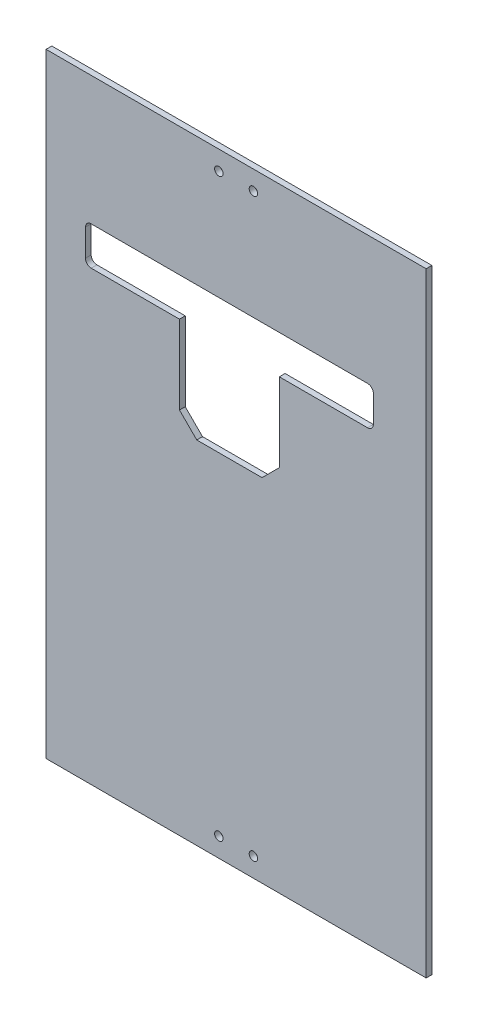
from build123d import *

# Parameters (mm, degrees)
ESQUISSE1_W                  = 198
ESQUISSE1_H                  = 320
BOSS_EXTRU_1_DEPTH           = 3
ENL_V_MAT_EXTRU_1_REACH      = 194.445
ESQUISSE2_R                  = 2.2
ENL_V_MAT_EXTRU_4_REACH      = 194.445
ESQUISSE5_W                  = 20
ESQUISSE5_H                  = 20
ENL_V_MAT_EXTRU_5_DEPTH      = 193.44479728
ENL_V_MAT_EXTRU_5_DEPTH_BACK = 193.44479728
ESQUISSE7_W                  = 37
ESQUISSE7_H                  = 20
ESQUISSE7_W_2                = 16
CONG_2_R                     = 3
ENL_V_MAT_EXTRU_6_REACH      = 194.445


with BuildPart() as part:
    # Esquisse1 → Boss.-Extru.1 (new body)
    with BuildSketch(Plane.XY):
        with Locations((0, 5)):
            Rectangle(ESQUISSE1_W, ESQUISSE1_H)
    extrude(amount=BOSS_EXTRU_1_DEPTH)

    # Esquisse2 → Enlèv. mat.-Extru.1 (cut, up to next)
    with BuildSketch(Plane.XY.offset(3), mode=Mode.PRIVATE) as enl_v_mat_extru_1_sk1:
        with Locations((9, -145)):
            Circle(ESQUISSE2_R)
    enl_v_mat_extru_1_tool1 = extrude(enl_v_mat_extru_1_sk1.sketch, amount=-ENL_V_MAT_EXTRU_1_REACH, mode=Mode.PRIVATE) & part.part
    # Esquisse2 → Enlèv. mat.-Extru.1 (cut, up to next)
    with BuildSketch(Plane.XY.offset(3), mode=Mode.PRIVATE) as enl_v_mat_extru_1_sk2:
        with Locations((-9, -145)):
            Circle(ESQUISSE2_R)
    enl_v_mat_extru_1_tool2 = extrude(enl_v_mat_extru_1_sk2.sketch, amount=-ENL_V_MAT_EXTRU_1_REACH, mode=Mode.PRIVATE) & part.part
    # Esquisse2 → Enlèv. mat.-Extru.1 (cut, up to next)
    with BuildSketch(Plane.XY.offset(3), mode=Mode.PRIVATE) as enl_v_mat_extru_1_sk3:
        with Locations((-9, 155)):
            Circle(ESQUISSE2_R)
    enl_v_mat_extru_1_tool3 = extrude(enl_v_mat_extru_1_sk3.sketch, amount=-ENL_V_MAT_EXTRU_1_REACH, mode=Mode.PRIVATE) & part.part
    # Esquisse2 → Enlèv. mat.-Extru.1 (cut, up to next)
    with BuildSketch(Plane.XY.offset(3), mode=Mode.PRIVATE) as enl_v_mat_extru_1_sk4:
        with Locations((9, 155)):
            Circle(ESQUISSE2_R)
    enl_v_mat_extru_1_tool4 = extrude(enl_v_mat_extru_1_sk4.sketch, amount=-ENL_V_MAT_EXTRU_1_REACH, mode=Mode.PRIVATE) & part.part
    add(enl_v_mat_extru_1_tool1.solids().sort_by_distance((9, -145, 3))[0], mode=Mode.SUBTRACT)
    add(enl_v_mat_extru_1_tool2.solids().sort_by_distance((-9, -145, 3))[0], mode=Mode.SUBTRACT)
    add(enl_v_mat_extru_1_tool3.solids().sort_by_distance((-9, 155, 3))[0], mode=Mode.SUBTRACT)
    add(enl_v_mat_extru_1_tool4.solids().sort_by_distance((9, 155, 3))[0], mode=Mode.SUBTRACT)

    # Esquisse5 → Enlèv. mat.-Extru.4 (cut, up to next)
    with BuildSketch(Plane.XY.offset(3), mode=Mode.PRIVATE) as enl_v_mat_extru_4_sk1:
        with Locations((-68.5, 88)):
            Rectangle(ESQUISSE5_W, ESQUISSE5_H)
    enl_v_mat_extru_4_tool1 = extrude(enl_v_mat_extru_4_sk1.sketch, amount=-ENL_V_MAT_EXTRU_4_REACH, mode=Mode.PRIVATE) & part.part
    # Esquisse5 → Enlèv. mat.-Extru.4 (cut, up to next)
    with BuildSketch(Plane.XY.offset(3), mode=Mode.PRIVATE) as enl_v_mat_extru_4_sk2:
        with Locations((-11.5, 88)):
            Rectangle(ESQUISSE5_W, ESQUISSE5_H)
    enl_v_mat_extru_4_tool2 = extrude(enl_v_mat_extru_4_sk2.sketch, amount=-ENL_V_MAT_EXTRU_4_REACH, mode=Mode.PRIVATE) & part.part
    # Esquisse5 → Enlèv. mat.-Extru.4 (cut, up to next)
    with BuildSketch(Plane.XY.offset(3), mode=Mode.PRIVATE) as enl_v_mat_extru_4_sk3:
        with Locations((45.5, 88)):
            Rectangle(ESQUISSE5_W, ESQUISSE5_H)
    enl_v_mat_extru_4_tool3 = extrude(enl_v_mat_extru_4_sk3.sketch, amount=-ENL_V_MAT_EXTRU_4_REACH, mode=Mode.PRIVATE) & part.part
    add(enl_v_mat_extru_4_tool1.solids().sort_by_distance((-68.5, 88, 3))[0], mode=Mode.SUBTRACT)
    add(enl_v_mat_extru_4_tool2.solids().sort_by_distance((-11.5, 88, 3))[0], mode=Mode.SUBTRACT)
    add(enl_v_mat_extru_4_tool3.solids().sort_by_distance((45.5, 88, 3))[0], mode=Mode.SUBTRACT)

    # Esquisse7 → Enlèv. mat.-Extru.5 (cut, two sides: drawn at the far end of the back side and taken through both)
    with BuildSketch(Plane.XY.offset(3).offset(-ENL_V_MAT_EXTRU_5_DEPTH_BACK)):
        with Locations((-40, 88)):
            Rectangle(ESQUISSE7_W, ESQUISSE7_H)
        with Locations((17, 88)):
            Rectangle(ESQUISSE7_W, ESQUISSE7_H)
        with Locations((63.5, 88)):
            Rectangle(ESQUISSE7_W_2, ESQUISSE7_H)
    extrude(amount=ENL_V_MAT_EXTRU_5_DEPTH + ENL_V_MAT_EXTRU_5_DEPTH_BACK, mode=Mode.SUBTRACT)

    # Congé2
    cong_2_edges = [part.edges().sort_by_distance(p)[0] for p in [
        (-78.5, 78, 1.5),
        (-78.5, 98, 1.5),
        (71.5, 98, 1.5),
        (71.5, 78, 1.5),
    ]]
    fillet(cong_2_edges, radius=CONG_2_R)

    # Esquisse9 → Enlèv. mat.-Extru.6 (cut, up to next)
    with BuildSketch(Plane.XY.offset(3), mode=Mode.PRIVATE) as enl_v_mat_extru_6_sk1:
        Polygon((-3.5, 28), (13.5, 28), (22.5, 37), (22.5, 78), (-29.5, 78), (-29.5, 37), (-20.5, 28), align=None)
    enl_v_mat_extru_6_tool1 = extrude(enl_v_mat_extru_6_sk1.sketch, amount=-ENL_V_MAT_EXTRU_6_REACH, mode=Mode.PRIVATE) & part.part
    add(enl_v_mat_extru_6_tool1.solids().sort_by_distance((-3.5, 53.707424, 3))[0], mode=Mode.SUBTRACT)


solid = part.part
